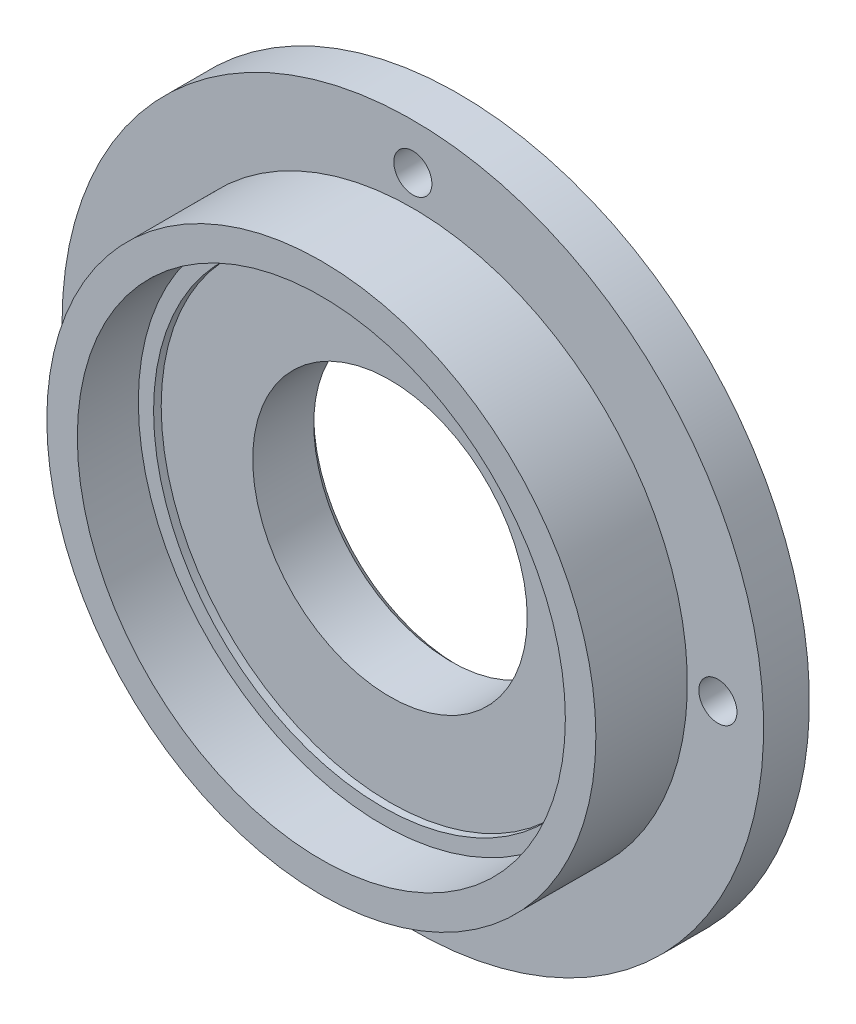
from build123d import *

# Parameters (mm, degrees)
SKETCH_1_R          = 18
EXTRUDE_3_DEPTH     = 9
SKETCH_4_R          = 16
CUT_EXTRUDE_1_DEPTH = 4
SKETCH_5_R          = 15
CUT_EXTRUDE_2_DEPTH = 0.5
SKETCH_7_R          = 9
CUT_EXTRUDE_3_DEPTH = 26.850531909
SKETCH_11_R         = 23
SKETCH_11_R_2       = 18
EXTRUDE_4_DEPTH     = 3
CHAMFER_2_SIZE      = 0.5
HOLE_WIZARD_M3_2_D  = 2.5


with BuildPart() as part:
    # 草图1 → 凸台-拉伸3 (new body)
    with BuildSketch(Plane.XY):
        Circle(SKETCH_1_R)
    extrude(amount=EXTRUDE_3_DEPTH)

    # 草图4 → 切除-拉伸1 (cut)
    with BuildSketch(Plane.XY.offset(9)):
        Circle(SKETCH_4_R)
    extrude(amount=-CUT_EXTRUDE_1_DEPTH, mode=Mode.SUBTRACT)

    # 草图5 → 切除-拉伸2 (cut)
    with BuildSketch(Plane.XY.offset(5)):
        Circle(SKETCH_5_R)
    extrude(amount=-CUT_EXTRUDE_2_DEPTH, mode=Mode.SUBTRACT)

    # 草图7 → 切除-拉伸3 (cut, through all)
    with BuildSketch(Plane.XY.offset(4.5)):
        Circle(SKETCH_7_R)
    extrude(amount=-CUT_EXTRUDE_3_DEPTH, mode=Mode.SUBTRACT)

    # 草图11 → 凸台-拉伸4 (add)
    with BuildSketch(Plane(origin=(0, 0, 0), x_dir=(-1, 0, 0), z_dir=(0, 0, -1))):
        Circle(SKETCH_11_R)
        Circle(SKETCH_11_R_2, mode=Mode.SUBTRACT)
    extrude(amount=-EXTRUDE_4_DEPTH)

    # 倒角2
    chamfer_2_edges = [part.edges().sort_by_distance(p)[0] for p in [
        (-9, 0, 0),
    ]]
    chamfer(chamfer_2_edges, length=CHAMFER_2_SIZE)

    # M3 螺纹孔2 (through all)
    with Locations(Plane(origin=(0, 0, 0), x_dir=(-1, 0, 0), z_dir=(0, 0, -1))):
        with Locations((0, 20), (-20, 0), (0, -20), (20, 0)):
            Hole(HOLE_WIZARD_M3_2_D / 2)


solid = part.part
